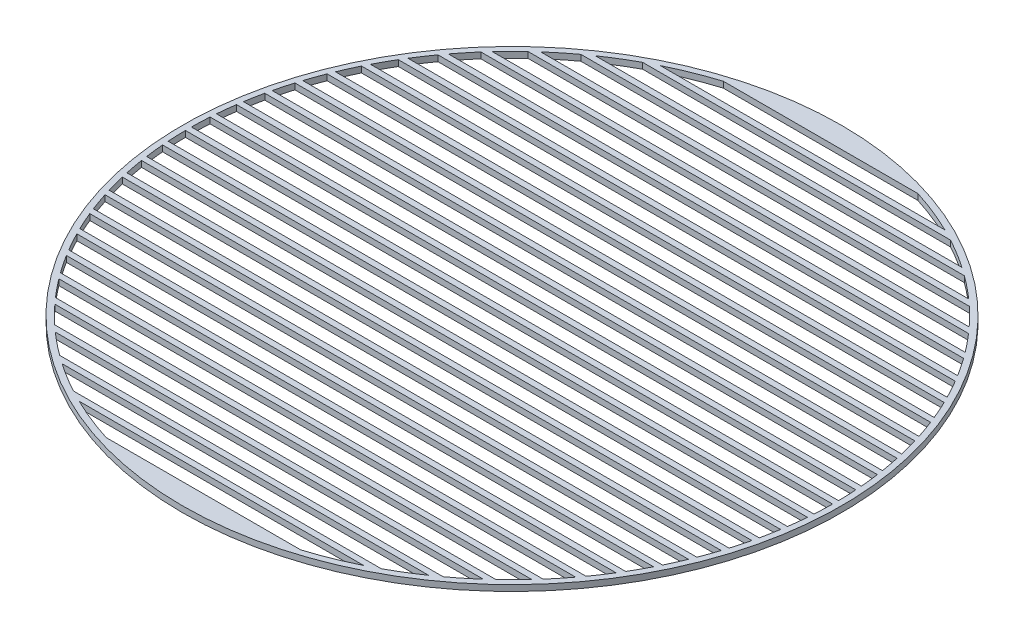
from build123d import *

# Parameters (mm, degrees)
SKETCH1_R           = 275
BOSS_EXTRUDE1_DEPTH = 5


with BuildPart() as part:
    # Sketch1 → Boss-Extrude1 (new body)
    with BuildSketch(Plane(origin=(0, 0, 0), x_dir=(1, 0, 0), z_dir=(0, 1, 0))):
        with Locations(Location((0, 0, 0), (0, 0, 270))):
            Circle(SKETCH1_R)
        with BuildLine():
            Line((269.988425678, 2.5), (-269.988425678, 2.5))
            ThreePointArc((-269.988425678, 2.5), (-269.814607969, 10.003865569), (-269.432273494, 17.5))
            Line((-269.432273494, 17.5), (269.432273494, 17.5))
            ThreePointArc((269.432273494, 17.5), (269.814607969, 10.003865569), (269.988425678, 2.5))
        make_face(mode=Mode.SUBTRACT)
        with BuildLine():
            Line((-269.988425678, -2.5), (269.988425678, -2.5))
            ThreePointArc((269.988425678, -2.5), (269.814607969, -10.003865569), (269.432273494, -17.5))
            Line((269.432273494, -17.5), (-269.432273494, -17.5))
            ThreePointArc((-269.432273494, -17.5), (-269.814607969, -10.003865569), (-269.988425678, -2.5))
        make_face(mode=Mode.SUBTRACT)
        with BuildLine():
            ThreePointArc((267.38315205, 37.5), (268.326846063, 30.011725736), (269.06086672, 22.5))
            Line((269.06086672, 22.5), (-269.06086672, 22.5))
            ThreePointArc((-269.06086672, 22.5), (-268.326846063, 30.011725736), (-267.38315205, 37.5))
            Line((-267.38315205, 37.5), (267.38315205, 37.5))
        make_face(mode=Mode.SUBTRACT)
        with BuildLine():
            ThreePointArc((263.806273618, 57.5), (265.326215877, 50.019987688), (266.634112596, 42.5))
            Line((266.634112596, 42.5), (-266.634112596, 42.5))
            ThreePointArc((-266.634112596, 42.5), (-265.326215877, 50.019987688), (-263.806273618, 57.5))
            Line((-263.806273618, 57.5), (263.806273618, 57.5))
        make_face(mode=Mode.SUBTRACT)
        with BuildLine():
            ThreePointArc((258.638260897, 77.5), (260.760317328, 70.02897191), (262.66661379, 62.5))
            Line((262.66661379, 62.5), (-262.66661379, 62.5))
            ThreePointArc((-262.66661379, 62.5), (-260.760317328, 70.02897191), (-258.638260897, 77.5))
            Line((-258.638260897, 77.5), (258.638260897, 77.5))
        make_face(mode=Mode.SUBTRACT)
        with BuildLine():
            ThreePointArc((251.781154974, 97.5), (254.544616671, 90.039092198), (257.087047515, 82.5))
            Line((257.087047515, 82.5), (-257.087047515, 82.5))
            ThreePointArc((-257.087047515, 82.5), (-254.544616671, 90.039092198), (-251.781154974, 97.5))
            Line((-251.781154974, 97.5), (251.781154974, 97.5))
        make_face(mode=Mode.SUBTRACT)
        with BuildLine():
            ThreePointArc((243.092060751, 117.5), (246.553834032, 110.050928774), (249.787409611, 102.5))
            Line((249.787409611, 102.5), (-249.787409611, 102.5))
            ThreePointArc((-249.787409611, 102.5), (-246.553834032, 110.050928774), (-243.092060751, 117.5))
            Line((-243.092060751, 117.5), (243.092060751, 117.5))
        make_face(mode=Mode.SUBTRACT)
        with BuildLine():
            ThreePointArc((232.365552524, 137.5), (236.607274446, 130.065359259), (240.611200903, 122.5))
            Line((240.611200903, 122.5), (-240.611200903, 122.5))
            ThreePointArc((-240.611200903, 122.5), (-236.607274446, 130.065359259), (-232.365552524, 137.5))
            Line((-232.365552524, 137.5), (232.365552524, 137.5))
        make_face(mode=Mode.SUBTRACT)
        with BuildLine():
            ThreePointArc((219.302872758, 157.5), (224.443417745, 150.083817353), (229.333272771, 142.5))
            Line((229.333272771, 142.5), (-229.333272771, 142.5))
            ThreePointArc((-229.333272771, 142.5), (-224.443417745, 150.083817353), (-219.302872758, 157.5))
            Line((-219.302872758, 157.5), (219.302872758, 157.5))
        make_face(mode=Mode.SUBTRACT)
        with BuildLine():
            ThreePointArc((203.454540377, 177.5), (209.673497347, 170.108860763), (215.624094201, 162.5))
            Line((215.624094201, 162.5), (-215.624094201, 162.5))
            ThreePointArc((-215.624094201, 162.5), (-209.673497347, 170.108860763), (-203.454540377, 177.5))
            Line((-203.454540377, 177.5), (203.454540377, 177.5))
        make_face(mode=Mode.SUBTRACT)
        with BuildLine():
            ThreePointArc((184.102552943, 197.5), (191.688946284, 190.145596511), (198.981783086, 182.5))
            Line((198.981783086, 182.5), (-198.981783086, 182.5))
            ThreePointArc((-198.981783086, 182.5), (-191.688946284, 190.145596511), (-184.102552943, 197.5))
            Line((-184.102552943, 197.5), (184.102552943, 197.5))
        make_face(mode=Mode.SUBTRACT)
        with BuildLine():
            ThreePointArc((159.980467558, 217.5), (169.450399668, 210.205999087), (178.588213497, 202.5))
            Line((178.588213497, 202.5), (-178.588213497, 202.5))
            ThreePointArc((-178.588213497, 202.5), (-169.450399668, 210.205999087), (-159.980467558, 217.5))
            Line((-159.980467558, 217.5), (159.980467558, 217.5))
        make_face(mode=Mode.SUBTRACT)
        with BuildLine():
            ThreePointArc((128.42799539, 237.5), (140.888842421, 230.326581361), (152.950155279, 222.5))
            Line((152.950155279, 222.5), (-152.950155279, 222.5))
            ThreePointArc((-152.950155279, 222.5), (-140.888842421, 230.326581361), (-128.42799539, 237.5))
            Line((-128.42799539, 237.5), (128.42799539, 237.5))
        make_face(mode=Mode.SUBTRACT)
        with BuildLine():
            ThreePointArc((81.201908845, 257.5), (100.240473836, 250.702707215), (118.717100706, 242.5))
            Line((118.717100706, 242.5), (-118.717100706, 242.5))
            ThreePointArc((-118.717100706, 242.5), (-100.240473836, 250.702707215), (-81.201908845, 257.5))
            Line((-81.201908845, 257.5), (81.201908845, 257.5))
        make_face(mode=Mode.SUBTRACT)
        with BuildLine():
            ThreePointArc((269.06086672, -22.5), (268.326846063, -30.011725736), (267.38315205, -37.5))
            Line((267.38315205, -37.5), (-267.38315205, -37.5))
            ThreePointArc((-267.38315205, -37.5), (-268.326846063, -30.011725736), (-269.06086672, -22.5))
            Line((-269.06086672, -22.5), (269.06086672, -22.5))
        make_face(mode=Mode.SUBTRACT)
        with BuildLine():
            ThreePointArc((-263.806273618, -57.5), (-265.326215877, -50.019987688), (-266.634112596, -42.5))
            Line((-266.634112596, -42.5), (266.634112596, -42.5))
            ThreePointArc((266.634112596, -42.5), (265.326215877, -50.019987688), (263.806273618, -57.5))
            Line((263.806273618, -57.5), (-263.806273618, -57.5))
        make_face(mode=Mode.SUBTRACT)
        with BuildLine():
            ThreePointArc((-258.638260897, -77.5), (-260.760317328, -70.02897191), (-262.66661379, -62.5))
            Line((-262.66661379, -62.5), (262.66661379, -62.5))
            ThreePointArc((262.66661379, -62.5), (260.760317328, -70.02897191), (258.638260897, -77.5))
            Line((258.638260897, -77.5), (-258.638260897, -77.5))
        make_face(mode=Mode.SUBTRACT)
        with BuildLine():
            ThreePointArc((-251.781154974, -97.5), (-254.544616671, -90.039092198), (-257.087047515, -82.5))
            Line((-257.087047515, -82.5), (257.087047515, -82.5))
            ThreePointArc((257.087047515, -82.5), (254.544616671, -90.039092198), (251.781154974, -97.5))
            Line((251.781154974, -97.5), (-251.781154974, -97.5))
        make_face(mode=Mode.SUBTRACT)
        with BuildLine():
            ThreePointArc((-243.092060751, -117.5), (-246.553834032, -110.050928774), (-249.787409611, -102.5))
            Line((-249.787409611, -102.5), (249.787409611, -102.5))
            ThreePointArc((249.787409611, -102.5), (246.553834032, -110.050928774), (243.092060751, -117.5))
            Line((243.092060751, -117.5), (-243.092060751, -117.5))
        make_face(mode=Mode.SUBTRACT)
        with BuildLine():
            ThreePointArc((-232.365552524, -137.5), (-236.607274446, -130.065359259), (-240.611200903, -122.5))
            Line((-240.611200903, -122.5), (240.611200903, -122.5))
            ThreePointArc((240.611200903, -122.5), (236.607274446, -130.065359259), (232.365552524, -137.5))
            Line((232.365552524, -137.5), (-232.365552524, -137.5))
        make_face(mode=Mode.SUBTRACT)
        with BuildLine():
            ThreePointArc((-219.302872758, -157.5), (-224.443417745, -150.083817353), (-229.333272771, -142.5))
            Line((-229.333272771, -142.5), (229.333272771, -142.5))
            ThreePointArc((229.333272771, -142.5), (224.443417745, -150.083817353), (219.302872758, -157.5))
            Line((219.302872758, -157.5), (-219.302872758, -157.5))
        make_face(mode=Mode.SUBTRACT)
        with BuildLine():
            ThreePointArc((-203.454540377, -177.5), (-209.673497347, -170.108860763), (-215.624094201, -162.5))
            Line((-215.624094201, -162.5), (215.624094201, -162.5))
            ThreePointArc((215.624094201, -162.5), (209.673497347, -170.108860763), (203.454540377, -177.5))
            Line((203.454540377, -177.5), (-203.454540377, -177.5))
        make_face(mode=Mode.SUBTRACT)
        with BuildLine():
            ThreePointArc((-184.102552943, -197.5), (-191.688946284, -190.145596511), (-198.981783086, -182.5))
            Line((-198.981783086, -182.5), (198.981783086, -182.5))
            ThreePointArc((198.981783086, -182.5), (191.688946284, -190.145596511), (184.102552943, -197.5))
            Line((184.102552943, -197.5), (-184.102552943, -197.5))
        make_face(mode=Mode.SUBTRACT)
        with BuildLine():
            ThreePointArc((-159.980467558, -217.5), (-169.450399668, -210.205999087), (-178.588213497, -202.5))
            Line((-178.588213497, -202.5), (178.588213497, -202.5))
            ThreePointArc((178.588213497, -202.5), (169.450399668, -210.205999087), (159.980467558, -217.5))
            Line((159.980467558, -217.5), (-159.980467558, -217.5))
        make_face(mode=Mode.SUBTRACT)
        with BuildLine():
            ThreePointArc((-128.42799539, -237.5), (-140.888842421, -230.326581361), (-152.950155279, -222.5))
            Line((-152.950155279, -222.5), (152.950155279, -222.5))
            ThreePointArc((152.950155279, -222.5), (140.888842421, -230.326581361), (128.42799539, -237.5))
            Line((128.42799539, -237.5), (-128.42799539, -237.5))
        make_face(mode=Mode.SUBTRACT)
        with BuildLine():
            ThreePointArc((-81.201908845, -257.5), (-100.240473836, -250.702707215), (-118.717100706, -242.5))
            Line((-118.717100706, -242.5), (118.717100706, -242.5))
            ThreePointArc((118.717100706, -242.5), (100.240473836, -250.702707215), (81.201908845, -257.5))
            Line((81.201908845, -257.5), (-81.201908845, -257.5))
        make_face(mode=Mode.SUBTRACT)
    extrude(amount=BOSS_EXTRUDE1_DEPTH)


solid = part.part
